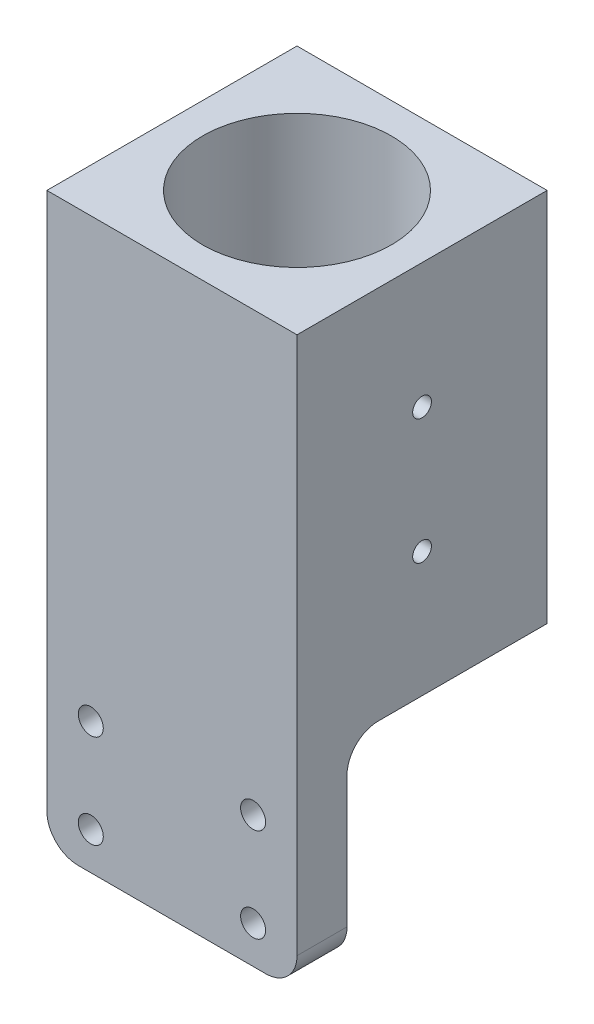
from build123d import *

# Parameters (mm, degrees)
SKETCH_1_W             = 40
SKETCH_1_H             = 40
EXTRUDE_1_DEPTH        = 60
SKETCH_2_R             = 15.1
CUT_EXTRUDE_1_DEPTH    = 50
SKETCH_3_W             = 40
SKETCH_3_H             = 31
SKETCH_3_R             = 2
EXTRUDE_2_DEPTH        = 8
SKETCH_4_R             = 1.5
CUT_EXTRUDE_2_DEPTH    = 75.833147735
PATTERN_LINEAR_1_COUNT = 2
PATTERN_LINEAR_1_PITCH = 20
FILLET_1_R             = 5


with BuildPart() as part:
    # 草圖1 → 填料-伸長1 (new body)
    with BuildSketch(Plane(origin=(0, 0, 0), x_dir=(1, 0, 0), z_dir=(0, 1, 0))):
        Rectangle(SKETCH_1_W, SKETCH_1_H)
    extrude(amount=EXTRUDE_1_DEPTH)

    # 草圖2 → 除料-伸長1 (cut)
    with BuildSketch(Plane(origin=(0, 60, 0), x_dir=(1, 0, 0), z_dir=(0, 1, 0))):
        with Locations(Location((0, 0, 0), (0, 0, 270))):
            Circle(SKETCH_2_R)
    extrude(amount=-CUT_EXTRUDE_1_DEPTH, mode=Mode.SUBTRACT)

    # 草圖3 → 填料-伸長2 (add)
    with BuildSketch(Plane.XY.offset(20)):
        with Locations((0, -15.5)):
            Rectangle(SKETCH_3_W, SKETCH_3_H)
        with Locations((-12.98, -10.004389258)):
            Circle(SKETCH_3_R, mode=Mode.SUBTRACT)
        with Locations((12.98, -10.004389258)):
            Circle(SKETCH_3_R, mode=Mode.SUBTRACT)
        with Locations((-12.98, -25.004389258)):
            Circle(SKETCH_3_R, mode=Mode.SUBTRACT)
        with Locations((12.98, -25.004389258)):
            Circle(SKETCH_3_R, mode=Mode.SUBTRACT)
    extrude(amount=-EXTRUDE_2_DEPTH)

    # 草圖4 → 除料-伸長2 (cut, through all)
    with BuildSketch(Plane(origin=(20, 0, 0), x_dir=(0, 0, -1), z_dir=(1, 0, 0))):
        with Locations((0, 20)):
            Circle(SKETCH_4_R)
    cut_extrude_2 = extrude(amount=-CUT_EXTRUDE_2_DEPTH, mode=Mode.SUBTRACT)

    # 直線複製排列1: 除料-伸長2 ×2
    with Locations(*[(0, i * PATTERN_LINEAR_1_PITCH, 0) for i in range(1, PATTERN_LINEAR_1_COUNT)]):
        add(cut_extrude_2, mode=Mode.SUBTRACT)

    # 圓角1
    fillet_1_edges = [part.edges().sort_by_distance(p)[0] for p in [
        (-20, -31, 16),
        (0, 0, 12),
        (20, -31, 16),
    ]]
    fillet(fillet_1_edges, radius=FILLET_1_R)


solid = part.part
